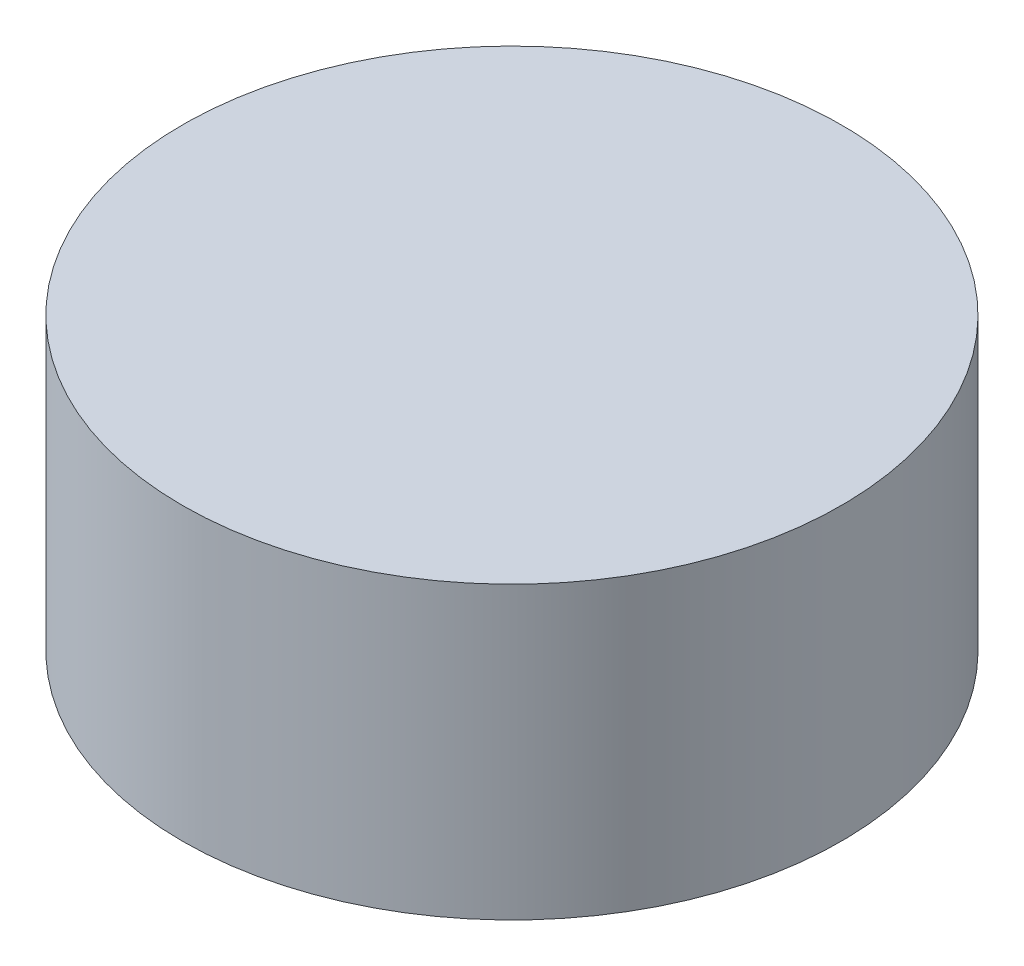
from build123d import *

# Parameters (mm, degrees)
SKETCH_7_R          = 17
EXTRUDE_6_DEPTH     = 15
SKETCH_8_R          = 1.5
CUT_EXTRUDE_2_DEPTH = 5
SKETCH_9_R          = 2
EXTRUDE_7_DEPTH     = 3.5


with BuildPart() as part:
    # Эскиз7 → Бобышка-Вытянуть6 (new body)
    with BuildSketch(Plane(origin=(0, 0, 0), x_dir=(1, 0, 0), z_dir=(0, 1, 0))):
        with Locations(Location((0, 0, 0), (0, 0, 270))):
            Circle(SKETCH_7_R)
    extrude(amount=EXTRUDE_6_DEPTH)

    # Эскиз8 → Вырез-Вытянуть2 (cut)
    with BuildSketch(Plane.XZ):
        with Locations(Location((-5.1, 8.833459119, 0), (0, 0, 270))):
            Circle(SKETCH_8_R)
        with Locations(Location((5.1, 8.833459119, 0), (0, 0, 270))):
            Circle(SKETCH_8_R)
        with Locations(Location((-10.2, 0, 0), (0, 0, 270))):
            Circle(SKETCH_8_R)
        with Locations(Location((-5.1, -8.833459119, 0), (0, 0, 270))):
            Circle(SKETCH_8_R)
        with Locations(Location((10.2, 0, 0), (0, 0, 270))):
            Circle(SKETCH_8_R)
        with Locations(Location((5.1, -8.833459119, 0), (0, 0, 270))):
            Circle(SKETCH_8_R)
    extrude(amount=-CUT_EXTRUDE_2_DEPTH, mode=Mode.SUBTRACT)

    # Эскиз9 → Бобышка-Вытянуть7 (add)
    with BuildSketch(Plane.XZ):
        with Locations(Location((8.660254038, 5, 0), (0, 0, 270))):
            Circle(SKETCH_9_R)
        with Locations(Location((0, -10, 0), (0, 0, 90))):
            Circle(SKETCH_9_R)
        with Locations(Location((-8.660254038, 5, 0), (0, 0, 90))):
            Circle(SKETCH_9_R)
    extrude(amount=EXTRUDE_7_DEPTH)


solid = part.part
